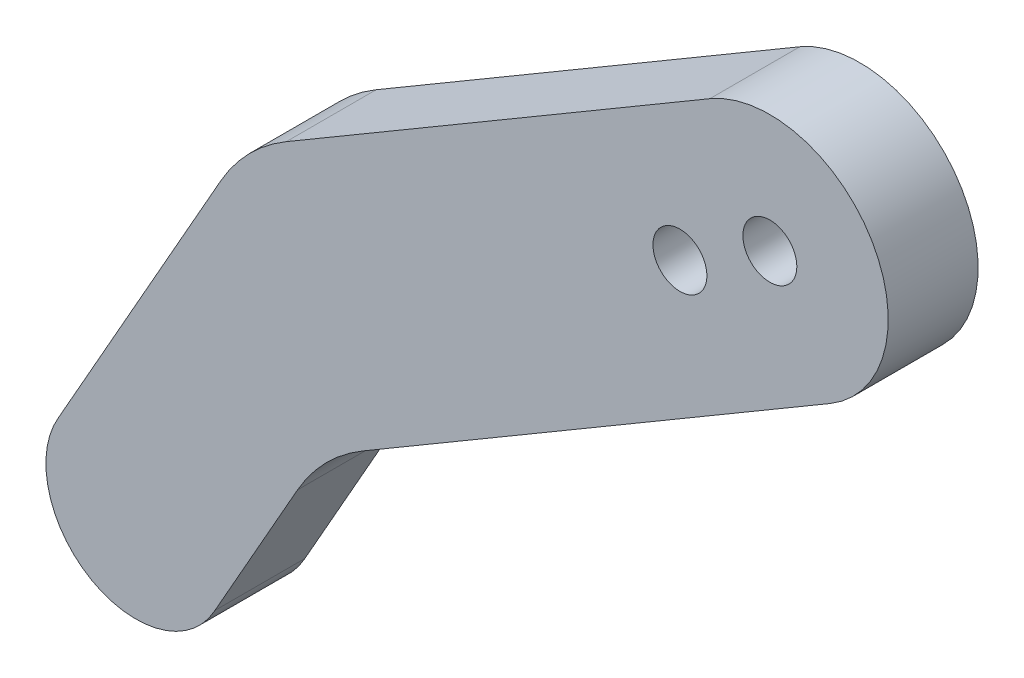
from build123d import *

# Parameters (mm, degrees)
BOSS_EXTRUDE1_DEPTH = 5
SKETCH4_R           = 1.5
CUT_EXTRUDE1_DEPTH  = 7


with BuildPart() as part:
    # Sketch3 → Boss-Extrude1 (new body)
    with BuildSketch(Plane.XY):
        with BuildLine():
            Line((0, 0), (9.035608105, 15.937339876))
            ThreePointArc((9.035608105, 15.937339876), (10.608511617, 18.020800767), (12.667059099, 19.626172065))
            Line((12.667059099, 19.626172065), (36.219511507, 33.471465384))
            ThreePointArc((36.219511507, 33.471465384), (45.226734814, 31.133502282), (42.888771713, 22.126278975))
            Line((42.888771713, 22.126278975), (16.927471829, 6.864946286))
            ThreePointArc((16.927471829, 6.864946286), (14.868924346, 5.259574989), (13.296020834, 3.176114098))
            Line((13.296020834, 3.176114098), (8.699180072, -4.931963714))
            ThreePointArc((8.699180072, -4.931963714), (1.838948591, -6.894344126), (0, 0))
        make_face()
    extrude(amount=BOSS_EXTRUDE1_DEPTH)

    # Sketch4 → Cut-Extrude1 (cut)
    with BuildSketch(Plane.XY.offset(5)):
        with Locations((39.55414161, 27.79887218)):
            Circle(SKETCH4_R)
        with Locations((34.55414161, 24.85962554)):
            Circle(SKETCH4_R)
    extrude(amount=-CUT_EXTRUDE1_DEPTH, mode=Mode.SUBTRACT)


solid = part.part
